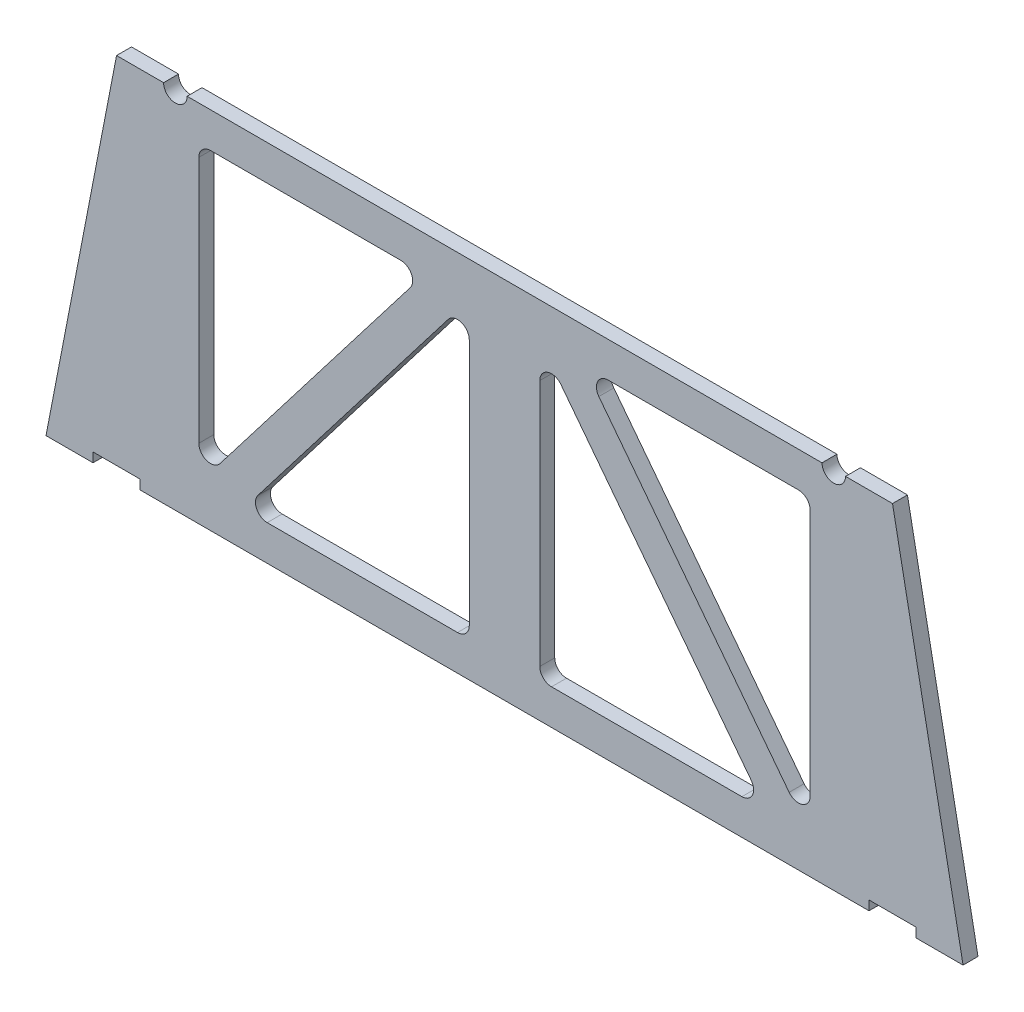
from build123d import *

# Parameters (mm, degrees)
EXTRUDE1_DEPTH = 6.35


with BuildPart() as part:
    # Sketch1 → Extrude1 (new body)
    with BuildSketch(Plane.XY):
        with BuildLine():
            Line((-155, -77.5), (155, -77.5))
            Line((155, -77.5), (155, -73.5))
            Line((155, -73.5), (175, -73.5))
            Line((175, -73.5), (175, -77.5))
            Line((175, -77.5), (195, -77.5))
            Line((195, -77.5), (165, 77.5))
            Line((165, 77.5), (145, 77.5))
            ThreePointArc((145, 77.5), (140, 72.5), (135, 77.5))
            Line((135, 77.5), (-135, 77.5))
            ThreePointArc((-135, 77.5), (-140, 72.5), (-145, 77.5))
            Line((-145, 77.5), (-165, 77.5))
            Line((-165, 77.5), (-195, -77.5))
            Line((-195, -77.5), (-175, -77.5))
            Line((-175, -77.5), (-175, -73.5))
            Line((-175, -73.5), (-155, -73.5))
            Line((-155, -73.5), (-155, -77.5))
        make_face()
        with BuildLine():
            Line((-130, 57.5), (-130, -47.790537842))
            ThreePointArc((-130, -47.790537842), (-126.609162538, -52.524520935), (-121.03576163, -50.837637143))
            Line((-121.03576163, -50.837637143), (-40.104522322, 54.4529007))
            ThreePointArc((-40.104522322, 54.4529007), (-39.583479402, 59.709581804), (-44.068760692, 62.5))
            Line((-44.068760692, 62.5), (-125, 62.5))
            ThreePointArc((-125, 62.5), (-128.535533906, 61.035533906), (-130, 57.5))
        make_face(mode=Mode.SUBTRACT)
        with BuildLine():
            Line((-104.895477678, -54.4529007), (-23.96423837, 50.837637143))
            ThreePointArc((-23.96423837, 50.837637143), (-18.390837462, 52.524520935), (-15, 47.790537842))
            Line((-15, 47.790537842), (-15, -57.5))
            ThreePointArc((-15, -57.5), (-16.464466094, -61.035533906), (-20, -62.5))
            Line((-20, -62.5), (-100.931239308, -62.5))
            ThreePointArc((-100.931239308, -62.5), (-105.416520598, -59.709581804), (-104.895477678, -54.4529007))
        make_face(mode=Mode.SUBTRACT)
        with BuildLine():
            Line((20, -62.5), (100.931239308, -62.5))
            ThreePointArc((100.931239308, -62.5), (105.416520598, -59.709581804), (104.895477678, -54.4529007))
            Line((104.895477678, -54.4529007), (23.96423837, 50.837637143))
            ThreePointArc((23.96423837, 50.837637143), (18.390837462, 52.524520935), (15, 47.790537842))
            Line((15, 47.790537842), (15, -57.5))
            ThreePointArc((15, -57.5), (16.464466094, -61.035533906), (20, -62.5))
        make_face(mode=Mode.SUBTRACT)
        with BuildLine():
            Line((44.068760692, 62.5), (125, 62.5))
            ThreePointArc((125, 62.5), (128.535533906, 61.035533906), (130, 57.5))
            Line((130, 57.5), (130, -47.790537842))
            ThreePointArc((130, -47.790537842), (126.609162538, -52.524520935), (121.03576163, -50.837637143))
            Line((121.03576163, -50.837637143), (40.104522322, 54.4529007))
            ThreePointArc((40.104522322, 54.4529007), (39.583479402, 59.709581804), (44.068760692, 62.5))
        make_face(mode=Mode.SUBTRACT)
    extrude(amount=EXTRUDE1_DEPTH)


solid = part.part
